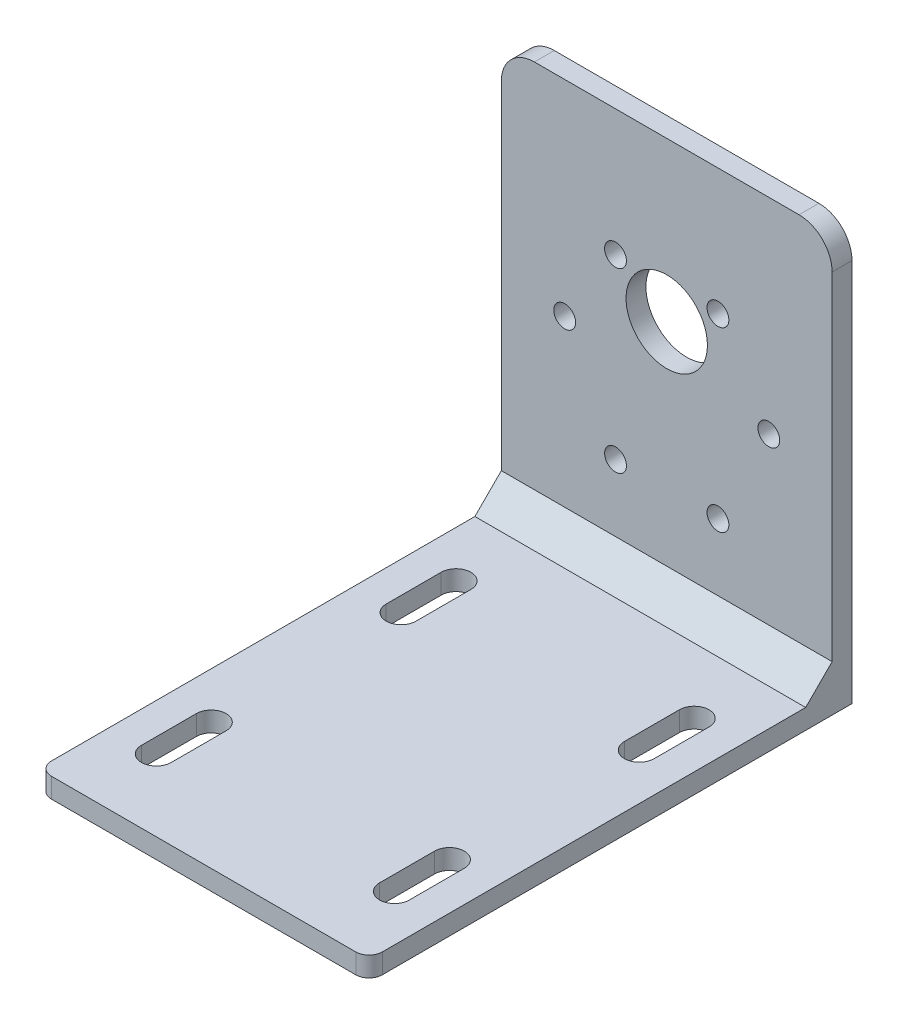
from build123d import *

# Parameters (mm, degrees)
EXTRUDE_2_DEPTH     = 3
SKETCH_2_W          = 50
SKETCH_2_H          = 3
EXTRUDE_3_DEPTH     = 3
SKETCH_3_W          = 50
SKETCH_3_H          = 3
EXTRUDE_5_DEPTH     = 70
CUT_EXTRUDE_1_DEPTH = 98.744565066
FILLET_1_R          = 5
FILLET_2_R          = 2
SKETCH_5_W          = 4
SKETCH_5_H          = 4
EXTRUDE_6_DEPTH     = 4
SKETCH_6_W          = 4
SKETCH_6_H          = 4
EXTRUDE_7_DEPTH     = 46
CUT_EXTRUDE_2_DEPTH = 95.435162943


with BuildPart() as part:
    # 草图1 → 凸台-拉伸2 (new body)
    with BuildSketch(Plane.XY):
        with BuildLine():
            Line((25, 6), (25, 30))
            Line((25, 30), (-25, 30))
            Line((-25, 30), (-25, 6))
            Line((-25, 6), (-16.431676725, 6))
            ThreePointArc((-16.431676725, 6), (0, 16), (16.431676725, 6))
            Line((16.431676725, 6), (25, 6))
        make_face()
        with BuildLine():
            Line((25, -30), (25, -1))
            Line((25, -1), (18.439088915, -1))
            ThreePointArc((18.439088915, -1), (18.484765956, -1.749381895), (18.5, -2.5))
            ThreePointArc((18.5, -2.5), (-4.374013065, -20.475483574), (-16.431676725, 6))
            Line((-16.431676725, 6), (-25, 6))
            Line((-25, 6), (-25, -30))
            Line((-25, -30), (25, -30))
        make_face()
        with BuildLine():
            Line((25, -1), (25, 6))
            Line((25, 6), (16.431676725, 6))
            ThreePointArc((16.431676725, 6), (17.783210455, 2.599747633), (18.439088915, -1))
            Line((18.439088915, -1), (25, -1))
        make_face()
        with BuildLine():
            ThreePointArc((18.5, -2.5), (18.484765956, -1.749381895), (18.439088915, -1))
            Line((18.439088915, -1), (17.077248621, -1))
            ThreePointArc((17.077248621, -1), (16.619172939, -2.1409717), (15.499289324, -2.648426564))
            ThreePointArc((15.499289324, -2.648426564), (13.783292906, -9.590192993), (9.133777755, -15.022943101))
            ThreePointArc((9.133777755, -15.022943101), (9.324554056, -15.446200161), (9.389869855, -15.905847832))
            ThreePointArc((9.389869855, -15.905847832), (8.134145395, -17.508048443), (6.278297978, -16.671555119))
            ThreePointArc((6.278297978, -16.671555119), (0, -18), (-6.278297978, -16.671555119))
            ThreePointArc((-6.278297978, -16.671555119), (-8.564869855, -17.334789748), (-9.133777755, -15.022943101))
            ThreePointArc((-9.133777755, -15.022943101), (-13.783292906, -9.590192993), (-15.499289324, -2.648426564))
            ThreePointArc((-15.499289324, -2.648426564), (-17.069504119, -0.840322581), (-15.18038717, 0.631428645))
            ThreePointArc((-15.18038717, 0.631428645), (-14.324684332, 3.420592774), (-12.961481397, 6))
            Line((-12.961481397, 6), (-16.431676725, 6))
            ThreePointArc((-16.431676725, 6), (-4.374013065, -20.475483574), (18.5, -2.5))
        make_face()
        with BuildLine():
            Line((12.961481397, 6), (16.431676725, 6))
            ThreePointArc((16.431676725, 6), (0, 16), (-16.431676725, 6))
            Line((-16.431676725, 6), (-12.961481397, 6))
            ThreePointArc((-12.961481397, 6), (-11.229253628, 8.184281115), (-9.133777755, 10.022943101))
            ThreePointArc((-9.133777755, 10.022943101), (-8.564869855, 12.334789748), (-6.278297978, 11.671555119))
            ThreePointArc((-6.278297978, 11.671555119), (0, 13), (6.278297978, 11.671555119))
            ThreePointArc((6.278297978, 11.671555119), (8.134145395, 12.508048443), (9.389869855, 10.905847832))
            ThreePointArc((9.389869855, 10.905847832), (9.324554056, 10.446200161), (9.133777755, 10.022943101))
            ThreePointArc((9.133777755, 10.022943101), (11.229253628, 8.184281115), (12.961481397, 6))
        make_face()
        with BuildLine():
            ThreePointArc((15.18038717, 0.631428645), (14.324684332, 3.420592774), (12.961481397, 6))
            Line((12.961481397, 6), (6.15, 6))
            ThreePointArc((6.15, 6), (0, -0.15), (-6.15, 6))
            Line((-6.15, 6), (-12.961481397, 6))
            ThreePointArc((-12.961481397, 6), (-14.324684332, 3.420592774), (-15.18038717, 0.631428645))
            ThreePointArc((-15.18038717, 0.631428645), (-14.176284714, 0.075913242), (-13.777248621, -1))
            ThreePointArc((-13.777248621, -1), (-14.286276921, -2.191924318), (-15.499289324, -2.648426564))
            ThreePointArc((-15.499289324, -2.648426564), (-13.783292906, -9.590192993), (-9.133777755, -15.022943101))
            ThreePointArc((-9.133777755, -15.022943101), (-7.280222183, -14.321163631), (-6.089869855, -15.905847832))
            ThreePointArc((-6.089869855, -15.905847832), (-6.137669243, -16.300123373), (-6.278297978, -16.671555119))
            ThreePointArc((-6.278297978, -16.671555119), (0, -18), (6.278297978, -16.671555119))
            ThreePointArc((6.278297978, -16.671555119), (6.914869855, -14.476905916), (9.133777755, -15.022943101))
            ThreePointArc((9.133777755, -15.022943101), (13.783292906, -9.590192993), (15.499289324, -2.648426564))
            ThreePointArc((15.499289324, -2.648426564), (13.784993122, -1.159677419), (15.18038717, 0.631428645))
        make_face()
        with BuildLine():
            Line((6.15, 6), (12.961481397, 6))
            ThreePointArc((12.961481397, 6), (11.229253628, 8.184281115), (9.133777755, 10.022943101))
            ThreePointArc((9.133777755, 10.022943101), (6.914869855, 9.476905916), (6.278297978, 11.671555119))
            ThreePointArc((6.278297978, 11.671555119), (0, 13), (-6.278297978, 11.671555119))
            ThreePointArc((-6.278297978, 11.671555119), (-6.137669243, 11.300123373), (-6.089869855, 10.905847832))
            ThreePointArc((-6.089869855, 10.905847832), (-7.280222183, 9.321163631), (-9.133777755, 10.022943101))
            ThreePointArc((-9.133777755, 10.022943101), (-11.229253628, 8.184281115), (-12.961481397, 6))
            Line((-12.961481397, 6), (-6.15, 6))
            ThreePointArc((-6.15, 6), (0, 12.15), (6.15, 6))
        make_face()
        with BuildLine():
            ThreePointArc((18.439088915, -1), (17.783210455, 2.599747633), (16.431676725, 6))
            Line((16.431676725, 6), (12.961481397, 6))
            ThreePointArc((12.961481397, 6), (14.324684332, 3.420592774), (15.18038717, 0.631428645))
            ThreePointArc((15.18038717, 0.631428645), (16.503161862, 0.250963907), (17.077248621, -1))
            Line((17.077248621, -1), (18.439088915, -1))
        make_face()
    extrude(amount=EXTRUDE_2_DEPTH)

    # 草图2 → 凸台-拉伸3 (add)
    with BuildSketch(Plane.XZ.offset(30)):
        with Locations((0, 1.5)):
            Rectangle(SKETCH_2_W, SKETCH_2_H)
    extrude(amount=EXTRUDE_3_DEPTH)

    # 草图3 → 凸台-拉伸5 (add)
    with BuildSketch(Plane.XY.offset(3)):
        with Locations((0, -31.5)):
            Rectangle(SKETCH_3_W, SKETCH_3_H)
    extrude(amount=EXTRUDE_5_DEPTH)

    # 草图4 → 切除-拉伸1 (cut, through all)
    with BuildSketch(Plane(origin=(0, -30, 0), x_dir=(1, 0, 0), z_dir=(0, 1, 0))):
        with BuildLine():
            Line((-15.75, -53.85), (-15.75, -62.15))
            ThreePointArc((-15.75, -62.15), (-18, -64.4), (-20.25, -62.15))
            Line((-20.25, -62.15), (-20.25, -53.85))
            ThreePointArc((-20.25, -53.85), (-18, -51.6), (-15.75, -53.85))
        make_face()
        with BuildLine():
            Line((15.75, -53.85), (15.75, -62.15))
            ThreePointArc((15.75, -62.15), (18, -64.4), (20.25, -62.15))
            Line((20.25, -62.15), (20.25, -53.85))
            ThreePointArc((20.25, -53.85), (18, -51.6), (15.75, -53.85))
        make_face()
        with BuildLine():
            Line((-15.75, -16.85), (-15.75, -25.15))
            ThreePointArc((-15.75, -25.15), (-18, -27.4), (-20.25, -25.15))
            Line((-20.25, -25.15), (-20.25, -16.85))
            ThreePointArc((-20.25, -16.85), (-18, -14.6), (-15.75, -16.85))
        make_face()
        with BuildLine():
            Line((15.75, -16.85), (15.75, -25.15))
            ThreePointArc((15.75, -25.15), (18, -27.4), (20.25, -25.15))
            Line((20.25, -25.15), (20.25, -16.85))
            ThreePointArc((20.25, -16.85), (18, -14.6), (15.75, -16.85))
        make_face()
    extrude(amount=-CUT_EXTRUDE_1_DEPTH, mode=Mode.SUBTRACT)

    # 圆角1
    fillet_1_edges = [part.edges().sort_by_distance(p)[0] for p in [
        (-25, 30, 1.5),
        (25, 30, 1.5),
    ]]
    fillet(fillet_1_edges, radius=FILLET_1_R)

    # 圆角2
    fillet_2_edges = [part.edges().sort_by_distance(p)[0] for p in [
        (25, -31.5, 73),
        (-25, -31.5, 73),
    ]]
    fillet(fillet_2_edges, radius=FILLET_2_R)

    # 草图5 → 凸台-拉伸6 (add)
    with BuildSketch(Plane(origin=(0, -30, 0), x_dir=(1, 0, 0), z_dir=(0, 1, 0))):
        with Locations((23, -5)):
            Rectangle(SKETCH_5_W, SKETCH_5_H)
    extrude(amount=EXTRUDE_6_DEPTH)

    # 草图6 → 凸台-拉伸7 (add)
    with BuildSketch(Plane.ZY.offset(-21)):
        with Locations((5, -28)):
            Rectangle(SKETCH_6_W, SKETCH_6_H)
    extrude(amount=EXTRUDE_7_DEPTH)

    # 草图7 → 切除-拉伸2 (cut, through all)
    with BuildSketch(Plane(origin=(25, 0, 0), x_dir=(0, 0, -1), z_dir=(1, 0, 0))):
        Polygon((-7, -30), (-7, -26), (-3, -26), align=None)
    extrude(amount=-CUT_EXTRUDE_2_DEPTH, mode=Mode.SUBTRACT)


solid = part.part
